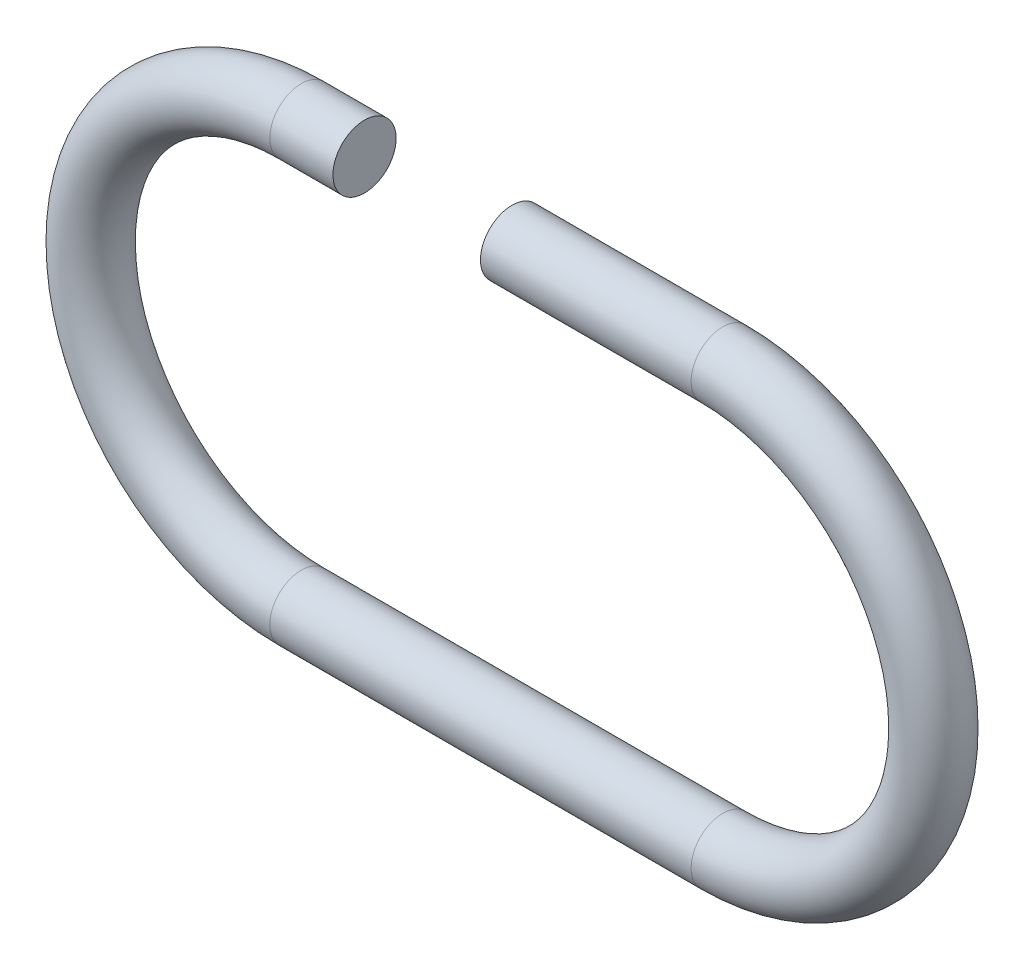
from build123d import *

# Parameters (mm, degrees)
SKETCH1_R = 1.5


with BuildPart() as part:
    # Sweep1: sweep along a path in Sketch2
    with BuildLine(Plane.XY) as sweep1_path:
        Line((0, 0), (10, 0))
        ThreePointArc((10, 0), (20, -10), (10, -20))
        Line((10, -20), (-10, -20))
        ThreePointArc((-10, -20), (-20, -10), (-10, 0))
        Line((-10, 0), (-7, 0))
    # Sketch1 → Sweep1 (sweep)
    with BuildSketch(Plane(origin=(0, 0, 0), x_dir=(0, 0, -1), z_dir=(1, 0, 0))):
        Circle(SKETCH1_R)
    sweep(path=sweep1_path.line)


solid = part.part
